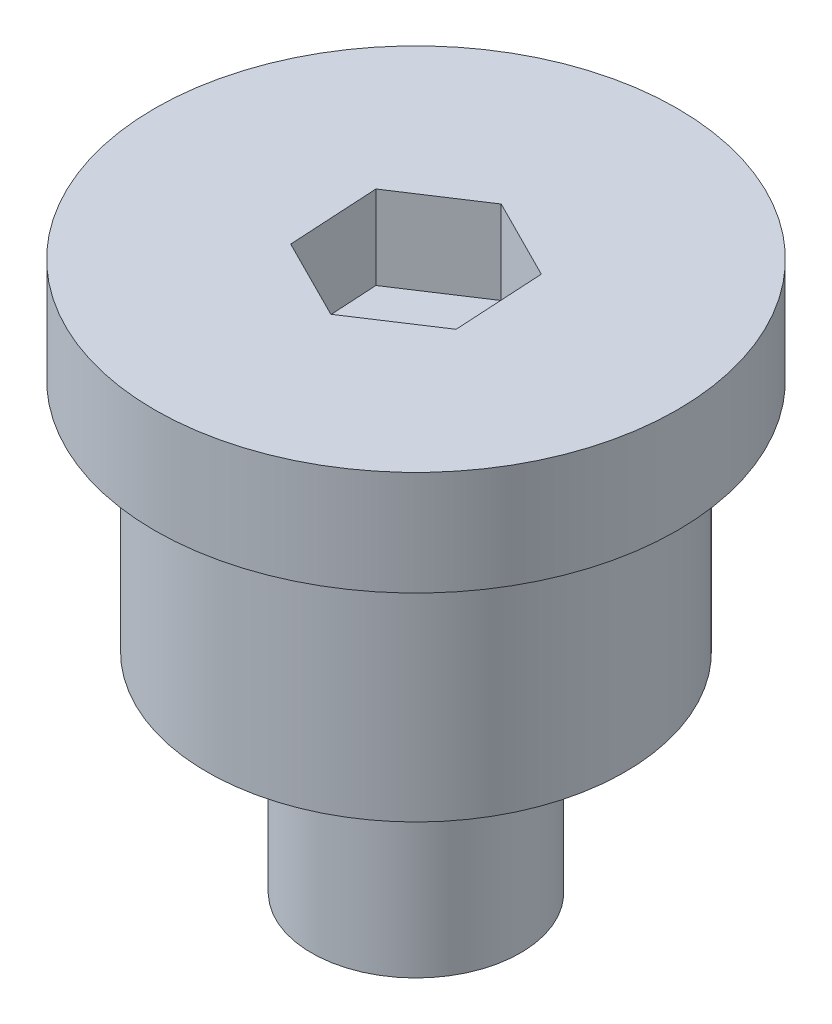
from build123d import *

# Parameters (mm, degrees)
CUT_EXTRUDE1_DEPTH = 2.54


with BuildPart() as part:
    # Sketch1 → Revolve1 (revolve)
    with BuildSketch(Plane(origin=(0, 0, 0), x_dir=(0, 0, -1), z_dir=(1, 0, 0)), mode=Mode.PRIVATE) as revolve1_sk:
        Polygon((0, 0), (0, 16.67256), (-7.9375, 16.67256), (-7.9375, 13.49756), (-6.35, 13.49756), (-6.35, 6.35), (-3.175, 6.35), (-3.175, 0), align=None)
    revolve(revolve1_sk.sketch.rotate(Axis((0, 0, 0), (0, 1, 0)), 180), axis=Axis((0, 0, 0), (0, 1, 0)))

    # Sketch2 → Cut-Extrude1 (cut)
    with BuildSketch(Plane(origin=(0, 16.67256, 0), x_dir=(1, 0, 0), z_dir=(0, 1, 0))):
        Polygon((-2.299363149, -1.507779114), (0.156093442, -2.745196457), (2.455456591, -1.237417343), (2.299363149, 1.507779114), (-0.156093442, 2.745196457), (-2.455456591, 1.237417343), align=None)
    extrude(amount=-CUT_EXTRUDE1_DEPTH, mode=Mode.SUBTRACT)


solid = part.part
